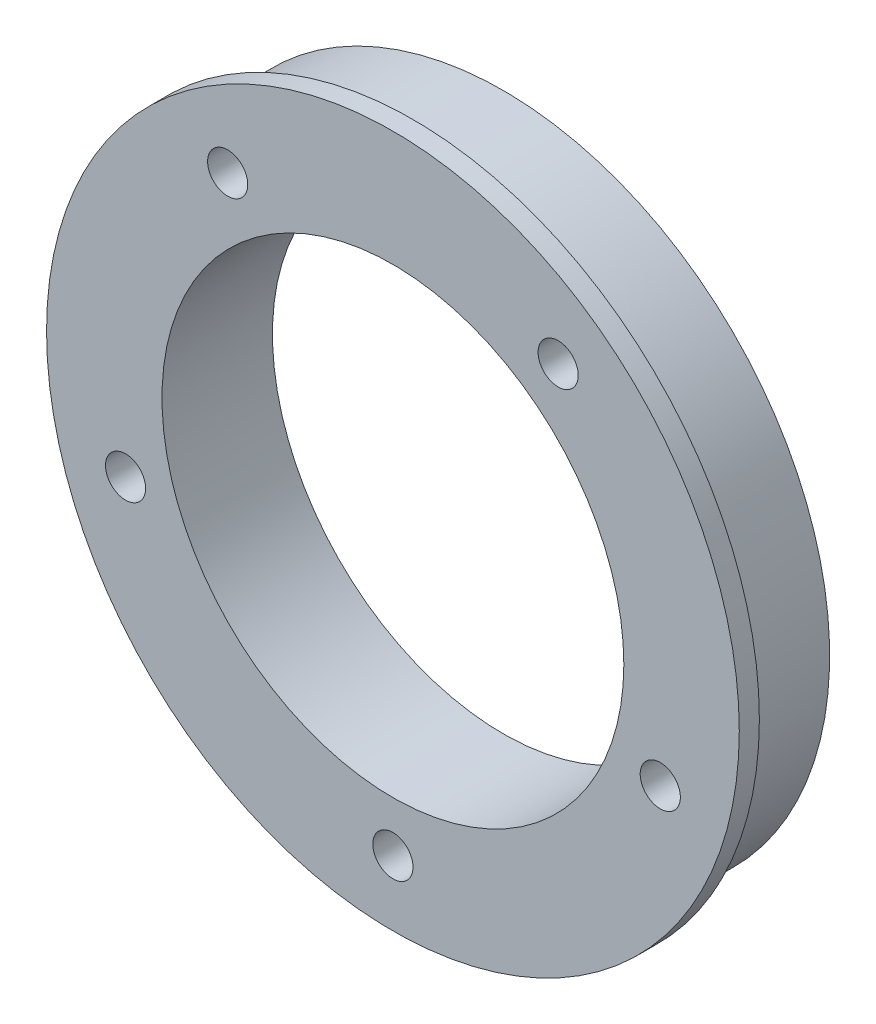
from build123d import *

# Parameters (mm, degrees)
SKETCH_1_R          = 34.5
SKETCH_1_R_2        = 23
SKETCH_1_R_3        = 2
EXTRUDE_1_DEPTH     = 11
SKETCH_2_R          = 34.5
SKETCH_2_R_2        = 32.5
CUT_EXTRUDE_1_DEPTH = 9


with BuildPart() as part:
    # 草图1 → 凸台-拉伸1 (new body)
    with BuildSketch(Plane.XY):
        Circle(SKETCH_1_R)
        Circle(SKETCH_1_R_2, mode=Mode.SUBTRACT)
        with Locations((0, -28)):
            Circle(SKETCH_1_R_3, mode=Mode.SUBTRACT)
        with Locations((-26.629582456, -8.652475842)):
            Circle(SKETCH_1_R_3, mode=Mode.SUBTRACT)
        with Locations((-16.457987064, 22.652475842)):
            Circle(SKETCH_1_R_3, mode=Mode.SUBTRACT)
        with Locations((16.457987064, 22.652475842)):
            Circle(SKETCH_1_R_3, mode=Mode.SUBTRACT)
        with Locations((26.629582456, -8.652475842)):
            Circle(SKETCH_1_R_3, mode=Mode.SUBTRACT)
    extrude(amount=EXTRUDE_1_DEPTH)

    # 草图2 → 切除-拉伸1 (cut)
    with BuildSketch(Plane(origin=(0, 0, 0), x_dir=(-1, 0, 0), z_dir=(0, 0, -1))):
        Circle(SKETCH_2_R)
        Circle(SKETCH_2_R_2, mode=Mode.SUBTRACT)
    extrude(amount=-CUT_EXTRUDE_1_DEPTH, mode=Mode.SUBTRACT)


solid = part.part
